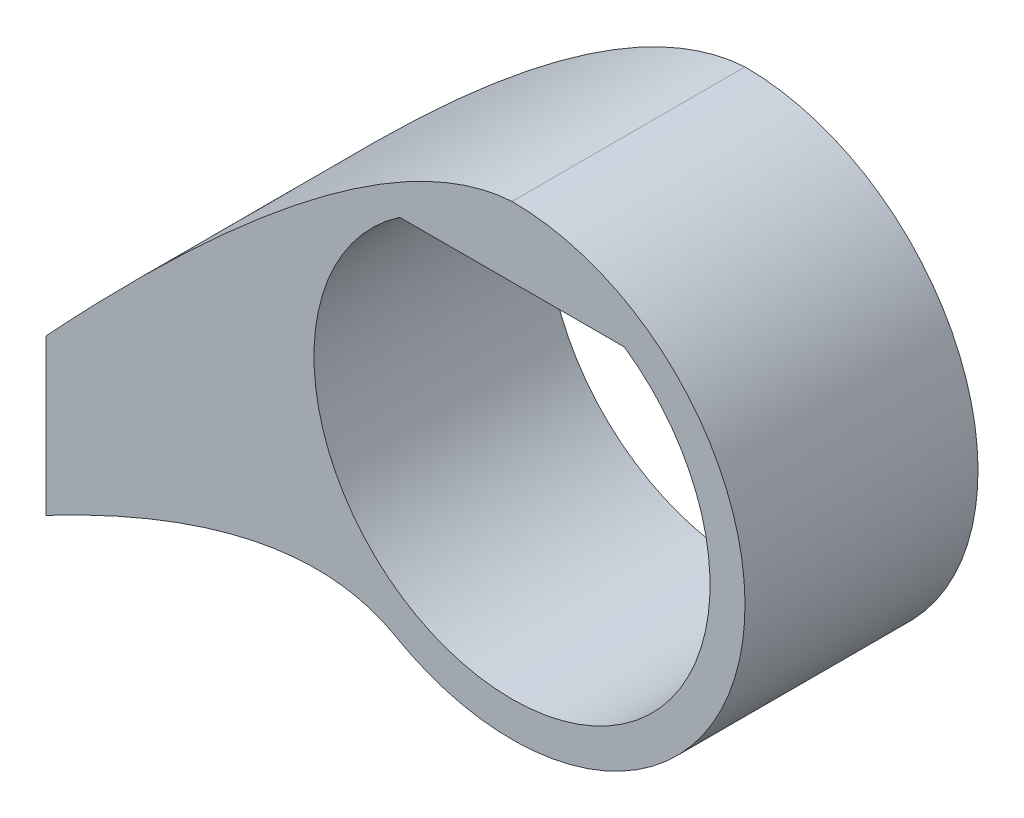
from build123d import *

# Parameters (mm, degrees)
AUFSATZ_LINEAR_AUSTRAGEN1_DEPTH = 6


with BuildPart() as part:
    # Skizze1 → Aufsatz-Linear austragen1 (new body)
    with BuildSketch(Plane.XY):
        with BuildLine():
            Line((-12, -7), (-12, -3))
            add(Edge.make_bspline(
                [(-12, -3), (-3.846414533, 5.771268296), (0, 6)],
                knots=[0, 0, 0, 0.663529029, 0.663529029, 0.663529029], degree=2))
            ThreePointArc((0, 6), (5.795554958, -1.552914271), (-3, -5.196152423))
            add(Edge.make_bspline(
                [(-12, -7), (-5.654241137, -3.663725588), (-3, -5.196152423)],
                knots=[0, 0, 0, 0.361848159, 0.361848159, 0.361848159], degree=2))
        make_face()
        with BuildLine():
            Line((2.893095228, 4.2), (-2.893095228, 4.2))
            ThreePointArc((-2.893095228, 4.2), (0, -5.1), (2.893095228, 4.2))
        make_face(mode=Mode.SUBTRACT)
    extrude(amount=AUFSATZ_LINEAR_AUSTRAGEN1_DEPTH)


solid = part.part
